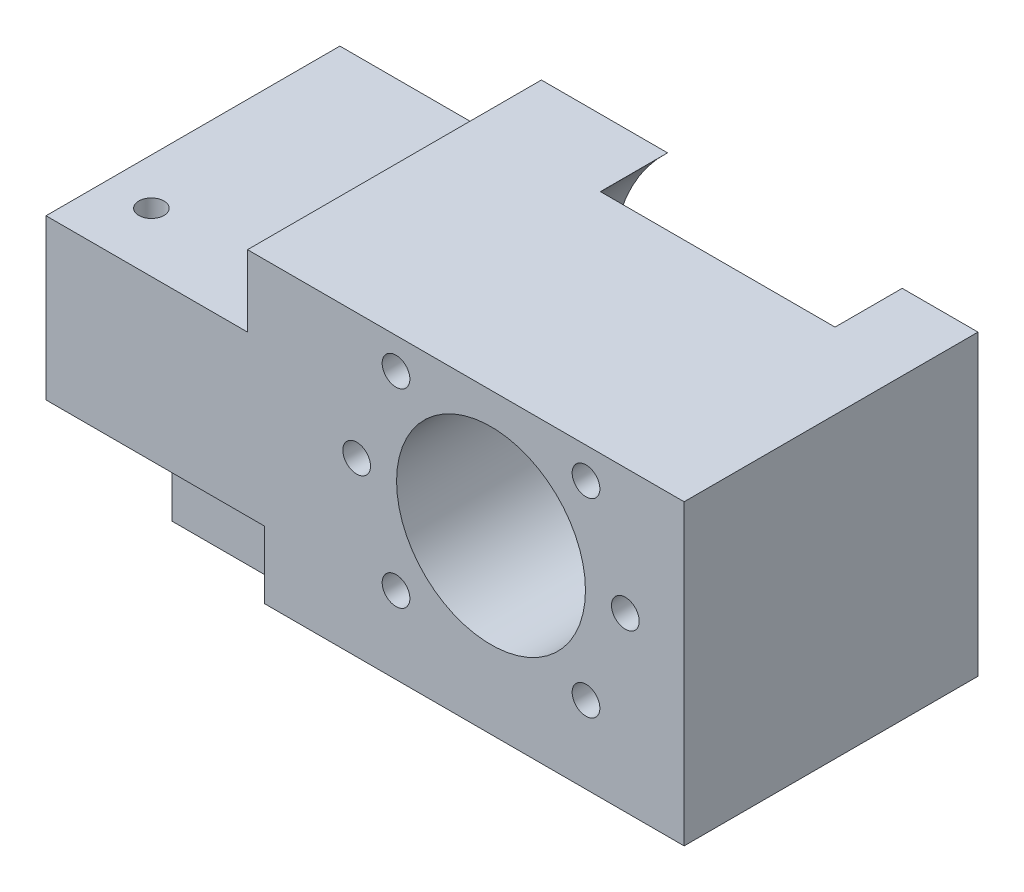
from build123d import *

# Parameters (mm, degrees)
SKETCH_1_W           = 70
SKETCH_1_H           = 30
EXTRUDE_1_DEPTH      = 27
CUT_EXTRUDE_1_DEPTH  = 47.679760068
SKETCH_3_R           = 1.65
CUT_EXTRUDE_2_DEPTH  = 47.679760068
SKETCH_4_W           = 21
SKETCH_4_H           = 8.5
CUT_EXTRUDE_3_DEPTH  = 47.679760068
SKETCH_7_R           = 11.25
CUT_EXTRUDE_5_DEPTH  = 47.679760068
SKETCH_8_W           = 21.5
SKETCH_8_H           = 21.5
EXTRUDE_2_DEPTH      = 8
SKETCH_10_R          = 1.5
CUT_EXTRUDE_6_DEPTH  = 54.422841557
SKETCH_12_W          = 35
SKETCH_12_H          = 21.5
EXTRUDE_3_DEPTH      = 3
SKETCH_13_R          = 3
CUT_EXTRUDE_7_DEPTH  = 15
SKETCH_14_R          = 1.65
EXTRUDE_4_DEPTH      = 27
SKETCH_15_W          = 27
SKETCH_15_H          = 30
EXTRUDE_5_DEPTH      = 3
EXTRUDE_START        = 5.5
SKETCH_16_R          = 3
EXTRUDE_6_DEPTH      = 5.5
SKETCH_22_W          = 26
SKETCH_22_H          = 15
CUT_EXTRUDE_9_DEPTH  = 8
EXTRUDE_START_2      = 8
SKETCH_20_R          = 11.25
EXTRUDE_8_DEPTH      = 8
CUT_EXTRUDE_8_DEPTH  = 8
SKETCH_23_W          = 26
SKETCH_23_H          = 20
EXTRUDE_9_DEPTH      = 17
SKETCH_24_R          = 2
CUT_EXTRUDE_10_DEPTH = 64.837684795
SKETCH_25_R          = 3.75
CUT_EXTRUDE_11_DEPTH = 5
SKETCH_26_R          = 3.1
CUT_EXTRUDE_12_DEPTH = 16
SKETCH_27_R          = 1.25
CUT_EXTRUDE_13_DEPTH = 10
SKETCH_28_W          = 2
SKETCH_28_H          = 12.06571985
CUT_EXTRUDE_14_DEPTH = 16
FILLET_1_R           = 2
SKETCH_29_W          = 20
SKETCH_29_H          = 5
CUT_EXTRUDE_15_DEPTH = 89.945207853


with BuildPart() as part:
    # 草图1 → 凸台-拉伸1 (new body)
    with BuildSketch(Plane.XY):
        Rectangle(SKETCH_1_W, SKETCH_1_H)
    extrude(amount=EXTRUDE_1_DEPTH)

    # 草图2 → 切除-拉伸1 (cut, through all)
    with BuildSketch(Plane.XY.offset(27)):
        with BuildLine():
            Line((28.228756555, -15), (35, -15))
            Line((35, -15), (35, 0))
            ThreePointArc((35, 0), (33.228756555, -8.228756555), (28.228756555, -15))
        make_face()
        with BuildLine():
            ThreePointArc((28.228756555, 15), (33.228756555, 8.228756555), (35, 0))
            Line((35, 0), (35, 15))
            Line((35, 15), (28.228756555, 15))
        make_face()
    extrude(amount=-CUT_EXTRUDE_1_DEPTH, mode=Mode.SUBTRACT)

    # 草图3 → 切除-拉伸2 (cut, through all)
    with BuildSketch(Plane.XY.offset(27)):
        with Locations((31, 0)):
            Circle(SKETCH_3_R)
        with Locations((26.313708499, 11.313708499)):
            Circle(SKETCH_3_R)
        with Locations(Location((26.313708499, -11.313708499, 0), (0, 0, 180))):
            Circle(SKETCH_3_R)
        with Locations(Location((3.686291501, 11.313708499, 0), (0, 0, 180))):
            Circle(SKETCH_3_R)
        with Locations((3.686291501, -11.313708499)):
            Circle(SKETCH_3_R)
        with Locations((-1, 0)):
            Circle(SKETCH_3_R)
    extrude(amount=-CUT_EXTRUDE_2_DEPTH, mode=Mode.SUBTRACT)

    # 草图4 → 切除-拉伸3 (cut, through all)
    with BuildSketch(Plane.XY.offset(27)):
        with Locations((-24.5, 10.75)):
            Rectangle(SKETCH_4_W, SKETCH_4_H)
    extrude(amount=-CUT_EXTRUDE_3_DEPTH, mode=Mode.SUBTRACT)

    # 草图7 → 切除-拉伸5 (cut, through all)
    with BuildSketch(Plane(origin=(0, 0, 0), x_dir=(-1, 0, 0), z_dir=(0, 0, -1))):
        with Locations((-15, 0)):
            Circle(SKETCH_7_R)
    extrude(amount=-CUT_EXTRUDE_5_DEPTH, mode=Mode.SUBTRACT)

    # 草图8 → 凸台-拉伸2 (add)
    with BuildSketch(Plane(origin=(0, 0, 0), x_dir=(-1, 0, 0), z_dir=(0, 0, -1))):
        with Locations((24.25, -4.25)):
            Rectangle(SKETCH_8_W, SKETCH_8_H)
    extrude(amount=EXTRUDE_2_DEPTH)

    # 草图10 → 切除-拉伸6 (cut, through all)
    with BuildSketch(Plane.XZ.offset(15)):
        with Locations(Location((-17.5, 19.95, 0), (0, 0, 270))):
            Circle(SKETCH_10_R)
        with Locations(Location((-32.5, 19.95, 0), (0, 0, 270))):
            Circle(SKETCH_10_R)
    extrude(amount=-CUT_EXTRUDE_6_DEPTH, mode=Mode.SUBTRACT)

    # 草图12 → 凸台-拉伸3 (add)
    with BuildSketch(Plane.ZY.offset(35)):
        with Locations((9.5, -4.25)):
            Rectangle(SKETCH_12_W, SKETCH_12_H)
    extrude(amount=EXTRUDE_3_DEPTH)

    # 草图13 → 切除-拉伸7 (cut)
    with BuildSketch(Plane.XZ.offset(15)):
        with Locations(Location((-32.5, 19.95, 0), (0, 0, 270))):
            Circle(SKETCH_13_R)
        with Locations(Location((-17.5, 19.95, 0), (0, 0, 270))):
            Circle(SKETCH_13_R)
    extrude(amount=-CUT_EXTRUDE_7_DEPTH, mode=Mode.SUBTRACT)

    # 草图14 → 凸台-拉伸4 (add)
    with BuildSketch(Plane.XY.offset(27)):
        Polygon((28.228756555, -15), (35, -15), (35, 0), (35, 15), (28.228756555, 15), (28.228756555, 12.920752662), (28.228756555, 9.706664336), (28.228756555, 0), (28.228756555, -9.706664336), (28.228756555, -12.920752662), align=None)
        with Locations((31, 0)):
            Circle(SKETCH_14_R, mode=Mode.SUBTRACT)
    extrude(amount=-EXTRUDE_4_DEPTH)

    # 草图15 → 凸台-拉伸5 (add)
    with BuildSketch(Plane(origin=(35, 0, 0), x_dir=(0, 0, -1), z_dir=(1, 0, 0))):
        with Locations((-13.5, 0)):
            Rectangle(SKETCH_15_W, SKETCH_15_H)
    extrude(amount=EXTRUDE_5_DEPTH)

    # 草图16 → 凸台-拉伸6 (add)
    with BuildSketch(Plane.XZ.offset(15).offset(EXTRUDE_START)):
        Polygon((-13.5, 0), (38, 0), (38, 27), (-38, 27), (-38, -8), (-13.5, -8), align=None)
        with Locations(Location((-32.5, 19.95, 0), (0, 0, 270))):
            Circle(SKETCH_16_R, mode=Mode.SUBTRACT)
        with Locations(Location((-17.5, 19.95, 0), (0, 0, 270))):
            Circle(SKETCH_16_R, mode=Mode.SUBTRACT)
    extrude(amount=-EXTRUDE_6_DEPTH)

    # 草图22 → 切除-拉伸9 (cut)
    with BuildSketch(Plane.XZ.offset(20.5)):
        with Locations((-25, 19.5)):
            Rectangle(SKETCH_22_W, SKETCH_22_H)
    extrude(amount=-CUT_EXTRUDE_9_DEPTH, mode=Mode.SUBTRACT)

    # 草图20 → 凸台-拉伸8 (add)
    with BuildSketch(Plane(origin=(0, 0, 0), x_dir=(-1, 0, 0), z_dir=(0, 0, -1)).offset(EXTRUDE_START_2)):
        Polygon((14, 15), (-38, 15), (-38, -20.5), (13.5, -20.5), (13.5, 6.5), (14, 6.5), align=None)
        with Locations((-15, 0)):
            Circle(SKETCH_20_R, mode=Mode.SUBTRACT)
    extrude(amount=-EXTRUDE_8_DEPTH)

    # 草图21 → 切除-拉伸8 (cut)
    with BuildSketch(Plane(origin=(0, 0, -8), x_dir=(-1, 0, 0), z_dir=(0, 0, -1))):
        with BuildLine():
            Line((-27.816005618, -16), (-2.183994382, -16))
            ThreePointArc((-2.183994382, -16), (-15, 20.5), (-27.816005618, -16))
        make_face()
    extrude(amount=-CUT_EXTRUDE_8_DEPTH, mode=Mode.SUBTRACT)

    # 草图23 → 凸台-拉伸9 (add)
    with BuildSketch(Plane.XZ.offset(20.5)):
        with Locations((-25, 2)):
            Rectangle(SKETCH_23_W, SKETCH_23_H)
    extrude(amount=EXTRUDE_9_DEPTH)

    # 草图24 → 切除-拉伸10 (cut, through all)
    with BuildSketch(Plane(origin=(0, 0, -8), x_dir=(-1, 0, 0), z_dir=(0, 0, -1))):
        with Locations((17, -27)):
            Circle(SKETCH_24_R)
        with Locations((25, -27)):
            Circle(SKETCH_24_R)
    extrude(amount=-CUT_EXTRUDE_10_DEPTH, mode=Mode.SUBTRACT)

    # 草图25 → 切除-拉伸11 (cut)
    with BuildSketch(Plane(origin=(0, 0, -8), x_dir=(-1, 0, 0), z_dir=(0, 0, -1))):
        with Locations((17, -27)):
            Circle(SKETCH_25_R)
        with Locations((25, -27)):
            Circle(SKETCH_25_R)
    extrude(amount=-CUT_EXTRUDE_11_DEPTH, mode=Mode.SUBTRACT)

    # 草图26 → 切除-拉伸12 (cut)
    with BuildSketch(Plane.XZ.offset(37.5)):
        with Locations(Location((-31, 7, 0), (0, 0, 270))):
            Circle(SKETCH_26_R)
    extrude(amount=-CUT_EXTRUDE_12_DEPTH, mode=Mode.SUBTRACT)

    # 草图27 → 切除-拉伸13 (cut)
    with BuildSketch(Plane.XZ.offset(21.5)):
        with Locations(Location((-31, 7, 0), (0, 0, 270))):
            Circle(SKETCH_27_R)
    extrude(amount=-CUT_EXTRUDE_13_DEPTH, mode=Mode.SUBTRACT)

    # 草图28 → 切除-拉伸14 (cut)
    with BuildSketch(Plane.XZ.offset(37.5)):
        with Locations((-31, -1.967140075)):
            Rectangle(SKETCH_28_W, SKETCH_28_H)
    extrude(amount=-CUT_EXTRUDE_14_DEPTH, mode=Mode.SUBTRACT)

    # 圆角1
    fillet_1_edges = [part.edges().sort_by_distance(p)[0] for p in [
        (-32, -29.5, 4.06571985),
        (-30, -29.5, 4.06571985),
    ]]
    fillet(fillet_1_edges, radius=FILLET_1_R)

    # 草图29 → 切除-拉伸15 (cut, through all)
    with BuildSketch(Plane.ZY.offset(38)):
        with Locations((2, -35)):
            Rectangle(SKETCH_29_W, SKETCH_29_H)
    extrude(amount=-CUT_EXTRUDE_15_DEPTH, mode=Mode.SUBTRACT)


solid = part.part
